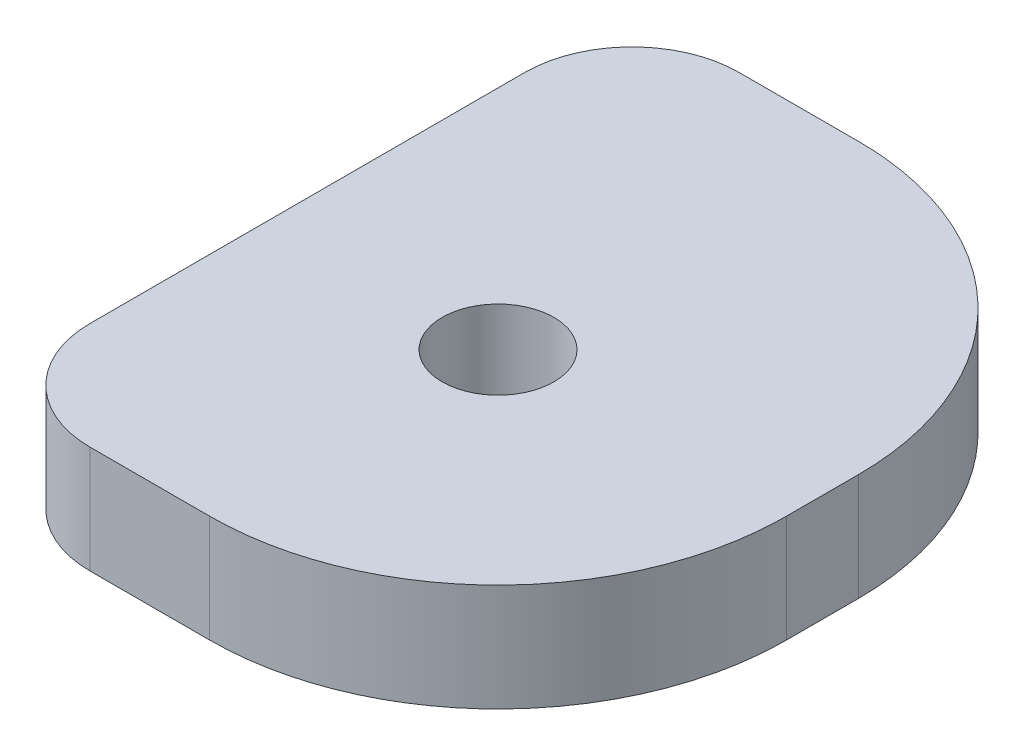
from build123d import *

# Parameters (mm, degrees)
SKETCH1_W           = 50.8
SKETCH1_H           = 22.86
BOSS_EXTRUDE1_DEPTH = 3.175
FILLET1_R           = 10.16
SKETCH3_R           = 1.9685
CUT_EXTRUDE1_DEPTH  = 29.033649869
FILLET3_R           = 10.16
SCALE1_SCALE_X      = 0.84
SCALE1_SCALE_Y      = 1
SCALE1_SCALE_Z      = 0.84
SKETCH4_W           = 27.432
SKETCH4_H           = 19.2024
CUT_EXTRUDE2_DEPTH  = 24.632305844
FILLET4_R           = 3.175


with BuildPart() as part:
    # Sketch1 → Boss-Extrude1 (new body)
    with BuildSketch(Plane(origin=(0, 0, 0), x_dir=(1, 0, 0), z_dir=(0, 1, 0))):
        Rectangle(SKETCH1_W, SKETCH1_H)
    extrude(amount=BOSS_EXTRUDE1_DEPTH)

    # Fillet1
    fillet1_edges = [part.edges().sort_by_distance(p)[0] for p in [
        (25.4, 1.5875, 11.43),
        (-25.4, 1.5875, 11.43),
    ]]
    fillet(fillet1_edges, radius=FILLET1_R)

    # Sketch3 → Cut-Extrude1 (cut, through all)
    with BuildSketch(Plane(origin=(0, 3.175, 0), x_dir=(1, 0, 0), z_dir=(0, 1, 0))):
        with Locations(Location((15.24, -1.27, 0), (0, 0, 270))):
            Circle(SKETCH3_R)
        with Locations(Location((-3.81, -1.27, 0), (0, 0, 270))):
            Circle(SKETCH3_R)
    extrude(amount=-CUT_EXTRUDE1_DEPTH, mode=Mode.SUBTRACT)

    # Fillet3
    fillet3_edges = [part.edges().sort_by_distance(p)[0] for p in [
        (-25.4, 1.5875, -11.43),
        (25.4, 1.5875, -11.43),
    ]]
    fillet(fillet3_edges, radius=FILLET3_R)


with BuildPart() as part_1:
    # Scale1: scaled about (-0.132729811, 1.5875, -0.029495513)
    add(part.part.scale((SCALE1_SCALE_X, SCALE1_SCALE_Y, SCALE1_SCALE_Z), about=(-0.132729811, 1.5875, -0.029495513)))

    # Sketch4 → Cut-Extrude2 (cut, through all)
    with BuildSketch(Plane(origin=(0, 0, 0), x_dir=(-1, 0, 0), z_dir=(0, -1, 0))):
        with Locations((7.64123677, 0.004719282)):
            Rectangle(SKETCH4_W, SKETCH4_H)
    extrude(amount=-CUT_EXTRUDE2_DEPTH, mode=Mode.SUBTRACT)

    # Fillet4
    fillet4_edges = [part_1.edges().sort_by_distance(p)[0] for p in [
        (6.07476323, 1.5875, 9.596480718),
        (6.07476323, 1.5875, -9.605919282),
    ]]
    fillet(fillet4_edges, radius=FILLET4_R)


solid = part_1.part
